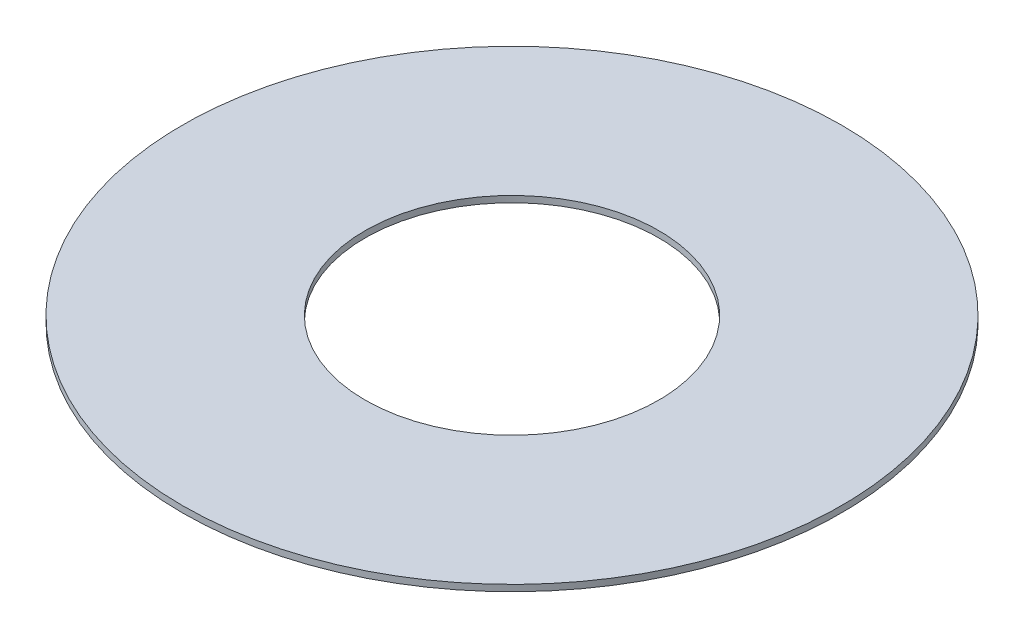
from build123d import *

# Parameters (mm, degrees)
SKETCH1_R           = 51.838
SKETCH1_R_2         = 23.1
BOSS_EXTRUDE1_DEPTH = 1


with BuildPart() as part:
    # Sketch1 → Boss-Extrude1 (new body)
    with BuildSketch(Plane(origin=(0, 0, 0), x_dir=(1, 0, 0), z_dir=(0, 1, 0))):
        with Locations(Location((0, 0, 0), (0, 0, 270))):
            Circle(SKETCH1_R)
        with Locations(Location((0, 0, 0), (0, 0, 270))):
            Circle(SKETCH1_R_2, mode=Mode.SUBTRACT)
    extrude(amount=BOSS_EXTRUDE1_DEPTH)


solid = part.part
